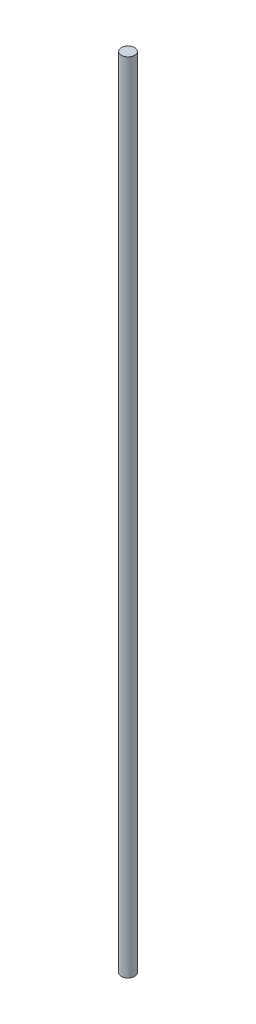
from build123d import *

# Parameters (mm, degrees)
SKETCH1_R           = 5
BOSS_EXTRUDE1_DEPTH = 600


with BuildPart() as part:
    # Sketch1 → Boss-Extrude1 (new body)
    with BuildSketch(Plane(origin=(0, 0, 0), x_dir=(1, 0, 0), z_dir=(0, 1, 0))):
        with Locations(Location((1.328390805, 0, 0), (0, 0, 270))):
            Circle(SKETCH1_R)
    extrude(amount=BOSS_EXTRUDE1_DEPTH)


solid = part.part
